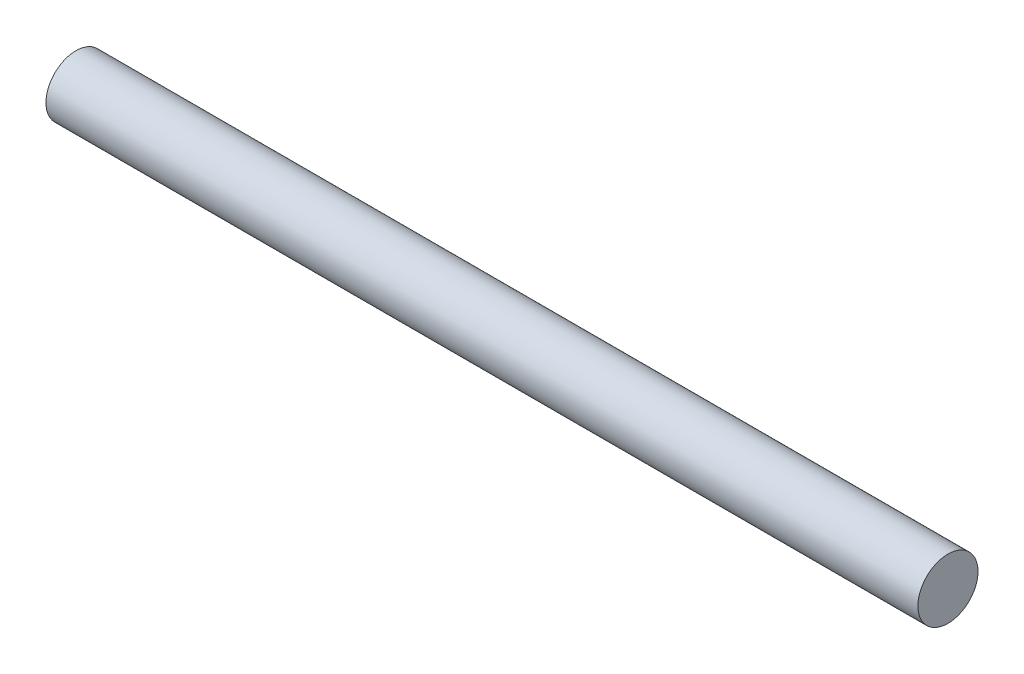
from build123d import *

# Parameters (mm, degrees)
SKETCH1_R           = 1.5875
BOSS_EXTRUDE1_DEPTH = 23.01875


with BuildPart() as part:
    # Sketch1 → Boss-Extrude1 (new, symmetric)
    with BuildSketch(Plane(origin=(0, 0, 0), x_dir=(0, 0, -1), z_dir=(1, 0, 0))):
        Circle(SKETCH1_R)
    extrude(amount=BOSS_EXTRUDE1_DEPTH, both=True)


solid = part.part
